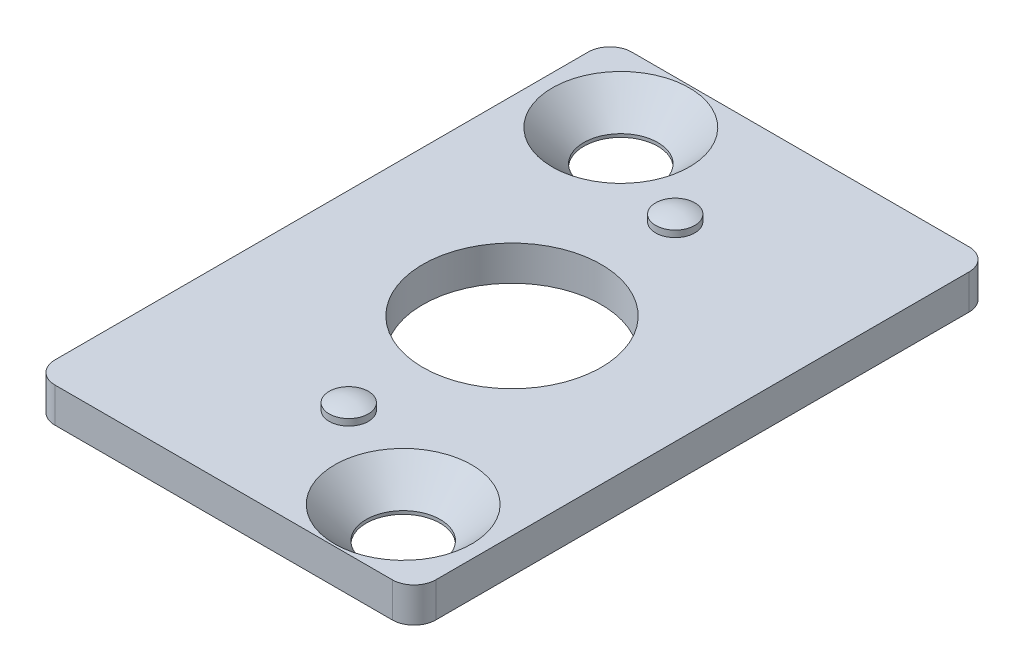
from build123d import *

# Parameters (mm, degrees)
BASES_W                                         = 17.5
BASES_H                                         = 26.5
BASE_DEPTH                                      = 1.6
CSK_FOR_M3_FLAT_HEAD_MACHINE_SCREW1_D           = 3.4
CSK_FOR_M3_FLAT_HEAD_MACHINE_SCREW1_DEPTH       = 11
CSK_FOR_M3_FLAT_HEAD_MACHINE_SCREW1_CSINK_D     = 6.3
CSK_FOR_M3_FLAT_HEAD_MACHINE_SCREW1_CSINK_ANGLE = 90
CSK_FOR_M3_FLAT_HEAD_MACHINE_SCREW1_TIP         = 1.021463052
BORES_R                                         = 4.1
BORE_DEPTH                                      = 16.958853342
LOCKINGFEATURES_R                               = 0.9
LOCKING_FEATURE_DEPTH                           = 0.3
LF_DOME_FACE_RADIUS                             = 0.9
LF_DOME_HEIGHT                                  = 0.2
LF_HM_COPY_1_FACE_RADIUS                        = 0.9
LF_HM_COPY_1_HEIGHT                             = 0.2
LFBOTTOMCUT_R                                   = 0.9
LF_BOTTOM_CUT_DEPTH                             = 0.3
BASE_FILLET_R                                   = 1


with BuildPart() as part:
    # BaseS → BASE (new body)
    with BuildSketch(Plane(origin=(0, 0, 0), x_dir=(1, 0, 0), z_dir=(0, 1, 0))):
        Rectangle(BASES_W, BASES_H)
    extrude(amount=-BASE_DEPTH)

    # CSK for M3 Flat Head Machine Screw1
    with Locations(Plane(origin=(0, 0, 0), x_dir=(1, 0, 0), z_dir=(0, 1, 0))):
        with Locations((-5, 10), (5, -10)):
            CounterSinkHole(CSK_FOR_M3_FLAT_HEAD_MACHINE_SCREW1_D / 2, CSK_FOR_M3_FLAT_HEAD_MACHINE_SCREW1_CSINK_D / 2, depth=CSK_FOR_M3_FLAT_HEAD_MACHINE_SCREW1_DEPTH, counter_sink_angle=CSK_FOR_M3_FLAT_HEAD_MACHINE_SCREW1_CSINK_ANGLE)
            with Locations((0, 0, -(CSK_FOR_M3_FLAT_HEAD_MACHINE_SCREW1_DEPTH + CSK_FOR_M3_FLAT_HEAD_MACHINE_SCREW1_TIP / 2))):  # 118° drill point
                Cone(0, CSK_FOR_M3_FLAT_HEAD_MACHINE_SCREW1_D / 2, CSK_FOR_M3_FLAT_HEAD_MACHINE_SCREW1_TIP, mode=Mode.SUBTRACT)

    # BoreS → BORE (cut, through all)
    with BuildSketch(Plane(origin=(0, 0, 0), x_dir=(1, 0, 0), z_dir=(0, 1, 0))):
        with Locations(Location((0, 0, 0), (0, 0, 270))):
            Circle(BORES_R)
    extrude(amount=-BORE_DEPTH, mode=Mode.SUBTRACT)

    # LockingFeatureS → LOCKING FEATURE (add)
    with BuildSketch(Plane(origin=(0, 0, 0), x_dir=(1, 0, 0), z_dir=(0, 1, 0))):
        with Locations(Location((0, 7.5, 0), (0, 0, 270))):
            Circle(LOCKINGFEATURES_R)
    locking_feature = extrude(amount=LOCKING_FEATURE_DEPTH)

    # LF DOME: a dome of height H over a round flat face of radius A is a cap of a sphere of radius (A * A + H * H) / (2 * H)
    lf_dome_r = (LF_DOME_FACE_RADIUS * LF_DOME_FACE_RADIUS + LF_DOME_HEIGHT * LF_DOME_HEIGHT) / (2 * LF_DOME_HEIGHT)
    lf_dome_base = Plane((0, 0.3, -7.5), z_dir=(0, 1, 0))
    with Locations(lf_dome_base.offset(LF_DOME_HEIGHT - lf_dome_r)):
        lf_dome_ball = Sphere(lf_dome_r, mode=Mode.PRIVATE)
    add(split(lf_dome_ball, bisect_by=lf_dome_base, keep=Keep.TOP, mode=Mode.PRIVATE))

    # LF HM: LOCKING FEATURE across plane
    add(locking_feature.mirror(Plane.XY))

    # LF HM copy 1: a dome of height H over a round flat face of radius A is a cap of a sphere of radius (A * A + H * H) / (2 * H)
    lf_hm_copy_1_r = (LF_HM_COPY_1_FACE_RADIUS * LF_HM_COPY_1_FACE_RADIUS + LF_HM_COPY_1_HEIGHT * LF_HM_COPY_1_HEIGHT) / (2 * LF_HM_COPY_1_HEIGHT)
    lf_hm_copy_1_base = Plane((0, 0.3, 7.5), z_dir=(0, 1, 0))
    with Locations(lf_hm_copy_1_base.offset(LF_HM_COPY_1_HEIGHT - lf_hm_copy_1_r)):
        lf_hm_copy_1_ball = Sphere(lf_hm_copy_1_r, mode=Mode.PRIVATE)
    add(split(lf_hm_copy_1_ball, bisect_by=lf_hm_copy_1_base, keep=Keep.TOP, mode=Mode.PRIVATE))

    # LFBottomCut → LF BOTTOM CUT (cut)
    with BuildSketch(Plane(origin=(0, -1.6, 0), x_dir=(-1, 0, 0), z_dir=(0, -1, 0))):
        with Locations(Location((0, 7.5, 0), (0, 0, 270))):
            Circle(LFBOTTOMCUT_R)
        with Locations(Location((0, -7.5, 0), (0, 0, 90))):
            Circle(LFBOTTOMCUT_R)
    extrude(amount=-LF_BOTTOM_CUT_DEPTH, mode=Mode.SUBTRACT)

    # BASE FILLET
    base_fillet_edges = [part.edges().sort_by_distance(p)[0] for p in [
        (8.75, -0.8, 13.25),
        (-8.75, -0.8, 13.25),
        (-8.75, -0.8, -13.25),
        (8.75, -0.8, -13.25),
    ]]
    fillet(base_fillet_edges, radius=BASE_FILLET_R)


solid = part.part
